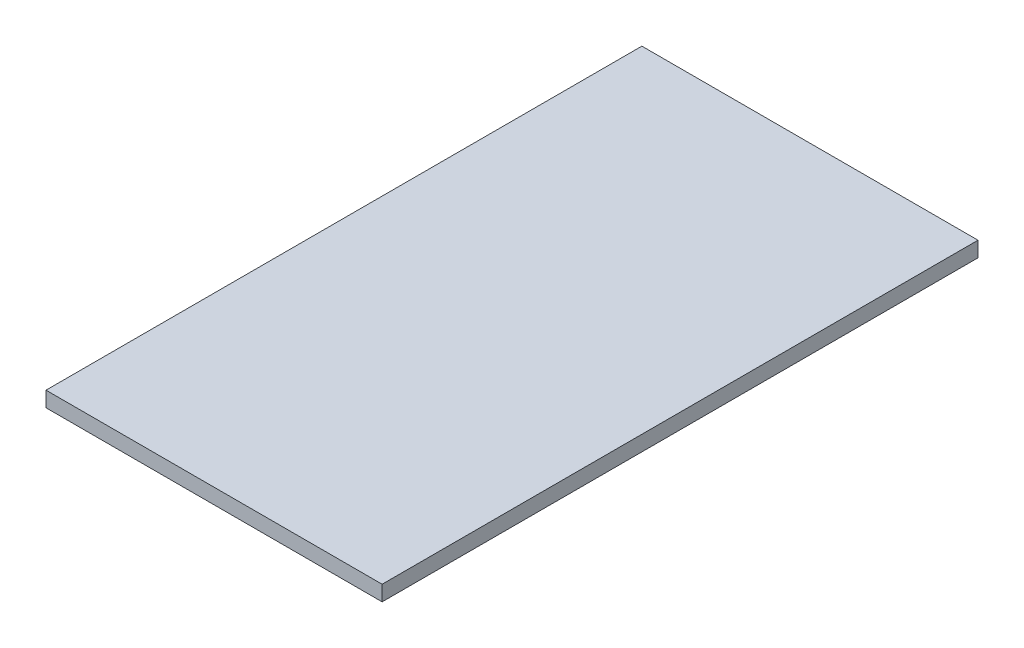
from build123d import *

# Parameters (mm, degrees)
SKETCH1_W           = 2.2
SKETCH1_H           = 3.9
BOSS_EXTRUDE1_DEPTH = 0.1


with BuildPart() as part:
    # Sketch1 → Boss-Extrude1 (new body)
    with BuildSketch(Plane(origin=(0, 0, 0), x_dir=(1, 0, 0), z_dir=(0, 1, 0))):
        Rectangle(SKETCH1_W, SKETCH1_H)
    extrude(amount=BOSS_EXTRUDE1_DEPTH)


solid = part.part
